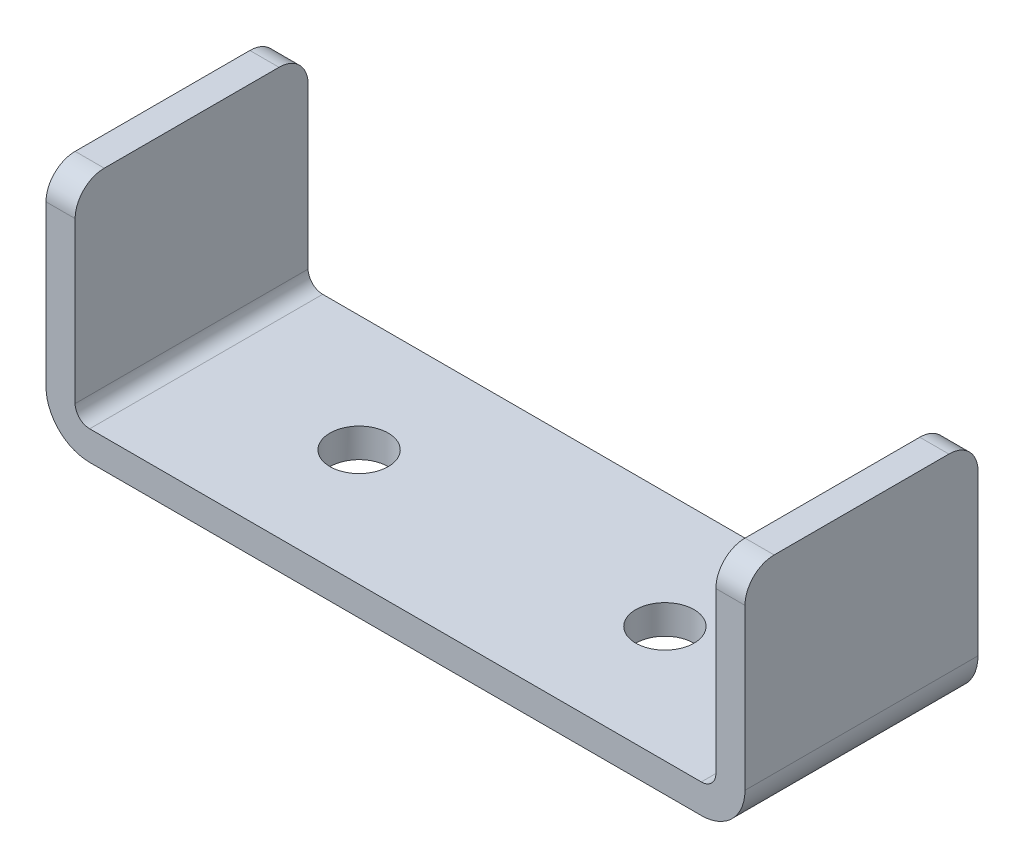
from build123d import *

# Parameters (mm, degrees)
EXTRUDE_THIN1_DEPTH = 25.4
FILLET1_R           = 3.175
SKETCH2_R           = 3.175
EXTRUDE1_DEPTH      = 25.4


with BuildPart() as part:
    # Sketch1 → Extrude-Thin1 (new body)
    with BuildSketch(Plane.XY):
        with BuildLine():
            Line((0, 25.4), (0, 4.7625))
            ThreePointArc((0, 4.7625), (1.394903955, 1.394903955), (4.7625, 0))
            Line((4.7625, 0), (71.4375, 0))
            ThreePointArc((71.4375, 0), (74.805096045, 1.394903955), (76.2, 4.7625))
            Line((76.2, 4.7625), (76.2, 25.4))
            Line((76.2, 25.4), (73.025, 25.4))
            Line((73.025, 25.4), (73.025, 4.7625))
            ThreePointArc((73.025, 4.7625), (72.560032015, 3.639967985), (71.4375, 3.175))
            Line((71.4375, 3.175), (4.7625, 3.175))
            ThreePointArc((4.7625, 3.175), (3.639967985, 3.639967985), (3.175, 4.7625))
            Line((3.175, 4.7625), (3.175, 25.4))
            Line((3.175, 25.4), (0, 25.4))
        make_face()
    extrude(amount=-EXTRUDE_THIN1_DEPTH)

    # Fillet1
    fillet1_edges = [part.edges().sort_by_distance(p)[0] for p in [
        (1.5875, 25.4, 0),
        (74.6125, 25.4, 0),
        (1.5875, 25.4, -25.4),
        (74.6125, 25.4, -25.4),
    ]]
    fillet(fillet1_edges, radius=FILLET1_R)

    # Sketch2 → Extrude1 (cut)
    with BuildSketch(Plane(origin=(0, 3.175, 0), x_dir=(-1, 0, 0), z_dir=(0, 1, 0))):
        with Locations(Location((-21.43125, -12.7, 0), (0, 0, 90))):
            Circle(SKETCH2_R)
        with Locations(Location((-54.76875, -12.7, 0), (0, 0, 270))):
            Circle(SKETCH2_R)
    extrude(amount=-EXTRUDE1_DEPTH, mode=Mode.SUBTRACT)


solid = part.part
